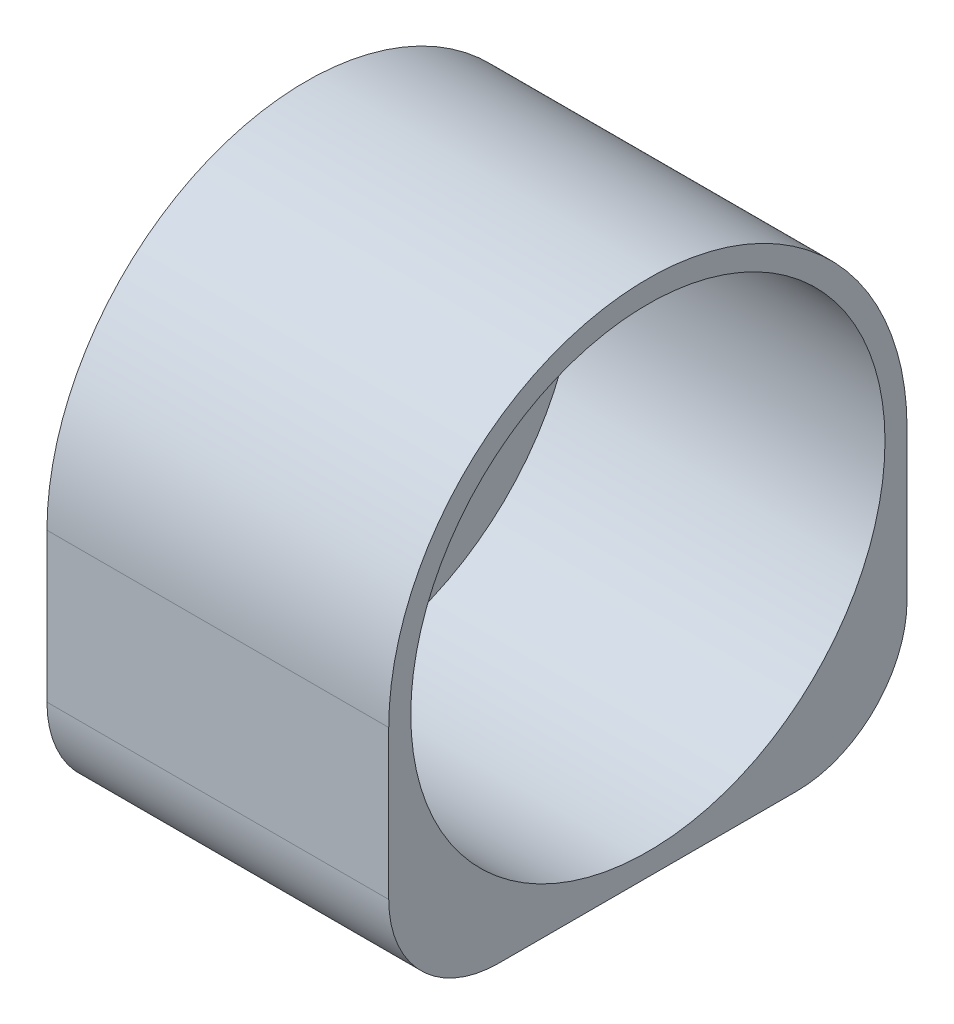
from build123d import *

# Parameters (mm, degrees)
SKETCH1_R           = 23.505813168
SKETCH1_R_2         = 21.505813168
BOSS_EXTRUDE1_DEPTH = 28
BOSS_EXTRUDE4_START = -3
SKETCH1_6_R         = 23.505813168
SKETCH1_6_R_2       = 21.505813168
SKETCH1_6_W         = 4
SKETCH1_6_H         = 13
BOSS_EXTRUDE4_DEPTH = 3
BOSS_EXTRUDE5_START = -31
BOSS_EXTRUDE5_DEPTH = 31
SKETCH3_R           = 10.5
CUT_EXTRUDE4_DEPTH  = 1


with BuildPart() as part:
    # Sketch1 → Boss-Extrude1 (new body)
    with BuildSketch(Plane.YZ):
        with Locations(Location((0, 0, 0), (0, 0, 270))):
            Circle(SKETCH1_R)
        with Locations(Location((0, 0, 0), (0, 0, 270))):
            Circle(SKETCH1_R_2, mode=Mode.SUBTRACT)
    extrude(amount=BOSS_EXTRUDE1_DEPTH)

    # Sketch1<6> → Boss-Extrude4 (add)
    # profile 1 of 5: a face of its own
    with BuildSketch(Plane.YZ.offset(BOSS_EXTRUDE4_START)):
        with Locations(Location((0, 0, 0), (0, 0, 270))):
            Circle(SKETCH1_6_R)
        with Locations(Location((0, 0, 0), (0, 0, 270))):
            Circle(SKETCH1_6_R_2, mode=Mode.SUBTRACT)
    # profile 2 of 5: a face of its own
    with BuildSketch(Plane.YZ.offset(BOSS_EXTRUDE4_START)):
        with BuildLine():
            Line((-20.5, -6.5), (-20.5, 6.5))
            ThreePointArc((-20.5, 6.5), (-21.505813168, 0), (-20.5, -6.5))
        make_face()
    # profile 3 of 5: a face of its own
    with BuildSketch(Plane.YZ.offset(BOSS_EXTRUDE4_START)):
        with Locations((-18.5, 0)):
            Rectangle(SKETCH1_6_W, SKETCH1_6_H)
    # profile 4 of 5: a face of its own
    with BuildSketch(Plane.YZ.offset(BOSS_EXTRUDE4_START)):
        with BuildLine():
            Line((-20.5, 6.5), (-16.5, 6.5))
            Line((-16.5, 6.5), (-7.925433742, 6.5))
            ThreePointArc((-7.925433742, 6.5), (3.451579649, 9.651378033), (10.25, 0))
            ThreePointArc((10.25, 0), (3.451579649, -9.651378033), (-7.925433742, -6.5))
            Line((-7.925433742, -6.5), (-16.5, -6.5))
            Line((-16.5, -6.5), (-20.5, -6.5))
            ThreePointArc((-20.5, -6.5), (3.288679831, -21.252872393), (21.505813168, 0))
            ThreePointArc((21.505813168, 0), (3.288679831, 21.252872393), (-20.5, 6.5))
        make_face()
    # profile 5 of 5: a face of its own
    with BuildSketch(Plane.YZ.offset(BOSS_EXTRUDE4_START)):
        with BuildLine():
            ThreePointArc((10.25, 0), (3.451579649, 9.651378033), (-7.925433742, 6.5))
            Line((-7.925433742, 6.5), (0, 6.5))
            Line((0, 6.5), (7.5, 6.5))
            Line((7.5, 6.5), (7.5, -6.5))
            Line((7.5, -6.5), (0, -6.5))
            Line((0, -6.5), (-7.925433742, -6.5))
            ThreePointArc((-7.925433742, -6.5), (3.451579649, -9.651378033), (10.25, 0))
        make_face()
    extrude(amount=BOSS_EXTRUDE4_DEPTH)

    # Sketch2 → Boss-Extrude5 (add)
    with BuildSketch(Plane.YZ.offset(28).offset(BOSS_EXTRUDE5_START)):
        with BuildLine():
            ThreePointArc((-23.505813168, 0), (-16.621119888, 16.621119888), (0, 23.505813168))
            Line((0, 23.505813168), (-13.505813168, 23.505813168))
            ThreePointArc((-13.505813168, 23.505813168), (-20.576880979, 20.576880979), (-23.505813168, 13.505813168))
            Line((-23.505813168, 13.505813168), (-23.505813168, 0))
        make_face()
        with BuildLine():
            ThreePointArc((0, -23.505813168), (-16.621119888, -16.621119888), (-23.505813168, 0))
            Line((-23.505813168, 0), (-23.505813168, -13.505813168))
            ThreePointArc((-23.505813168, -13.505813168), (-20.576880979, -20.576880979), (-13.505813168, -23.505813168))
            Line((-13.505813168, -23.505813168), (0, -23.505813168))
        make_face()
    extrude(amount=BOSS_EXTRUDE5_DEPTH)

    # Sketch3 → Cut-Extrude4 (cut)
    with BuildSketch(Plane.XZ.offset(23.505813168)):
        with Locations(Location((12.372081248, 0, 0), (0, 0, 270))):
            Circle(SKETCH3_R)
    extrude(amount=-CUT_EXTRUDE4_DEPTH, mode=Mode.SUBTRACT)


solid = part.part
